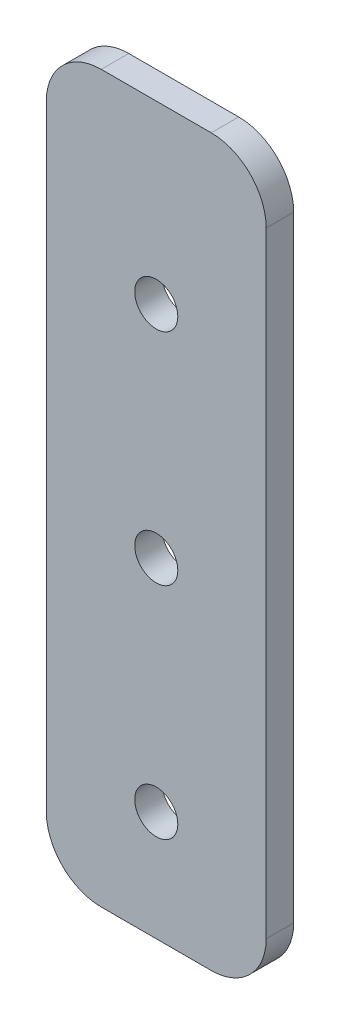
from build123d import *

# Parameters (mm, degrees)
SKETCH1_W           = 25.4
SKETCH1_H           = 83.82
BOSS_EXTRUDE1_DEPTH = 3.175
SKETCH2_R           = 2.4892
CUT_EXTRUDE1_DEPTH  = 88.641502868
FILLET1_R           = 6.35


with BuildPart() as part:
    # Sketch1 → Boss-Extrude1 (new body)
    with BuildSketch(Plane.XY):
        with Locations((12.7, 41.91)):
            Rectangle(SKETCH1_W, SKETCH1_H)
    extrude(amount=BOSS_EXTRUDE1_DEPTH)

    # Sketch2 → Cut-Extrude1 (cut, through all)
    with BuildSketch(Plane.XY.offset(3.175)):
        with Locations((12.7, 12.7)):
            Circle(SKETCH2_R)
        with Locations((12.7, 38.1)):
            Circle(SKETCH2_R)
        with Locations((12.7, 63.5)):
            Circle(SKETCH2_R)
    extrude(amount=-CUT_EXTRUDE1_DEPTH, mode=Mode.SUBTRACT)

    # Fillet1
    fillet1_edges = [part.edges().sort_by_distance(p)[0] for p in [
        (0, 83.82, 1.5875),
        (25.4, 83.82, 1.5875),
        (25.4, 0, 1.5875),
        (0, 0, 1.5875),
    ]]
    fillet(fillet1_edges, radius=FILLET1_R)


solid = part.part
